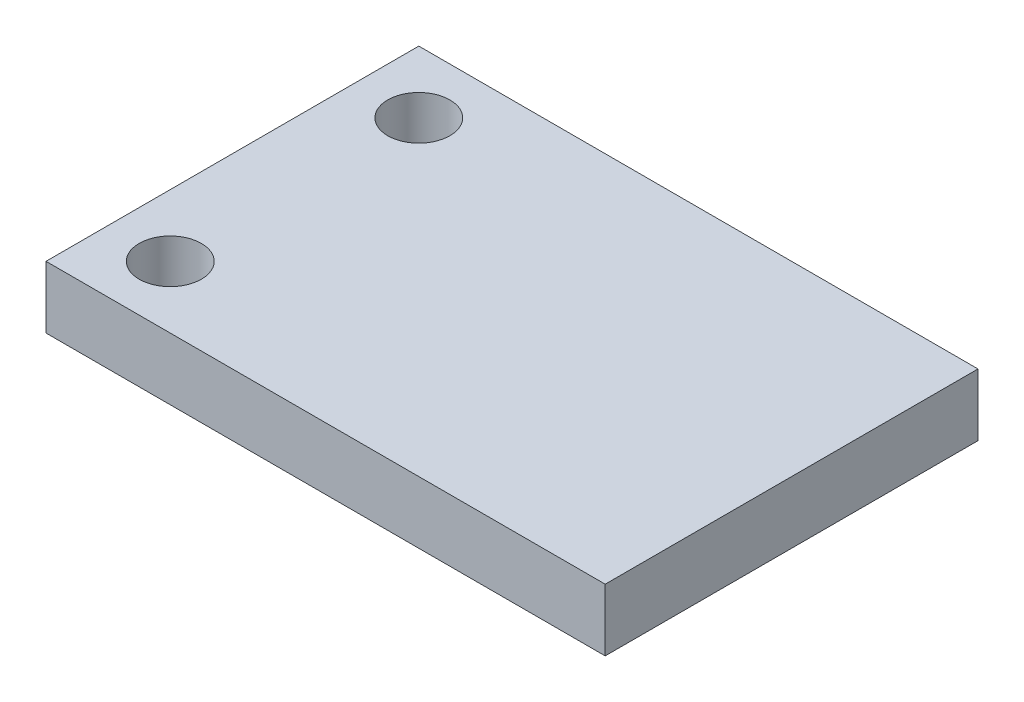
from build123d import *

# Parameters (mm, degrees)
SZKIC1_W                    = 90
SZKIC1_H                    = 60
SZKIC1_R                    = 5
DODANIE_WYCI_GNI_CIE1_DEPTH = 10


with BuildPart() as part:
    # Szkic1 → Dodanie-wyciągnięcie1 (new body)
    with BuildSketch(Plane(origin=(0, 0, 0), x_dir=(1, 0, 0), z_dir=(0, 1, 0))):
        with Locations((45, 30)):
            Rectangle(SZKIC1_W, SZKIC1_H)
        with Locations(Location((10, 50, 0), (0, 0, 270))):
            Circle(SZKIC1_R, mode=Mode.SUBTRACT)
        with Locations(Location((10, 10, 0), (0, 0, 270))):
            Circle(SZKIC1_R, mode=Mode.SUBTRACT)
    extrude(amount=DODANIE_WYCI_GNI_CIE1_DEPTH)


solid = part.part
